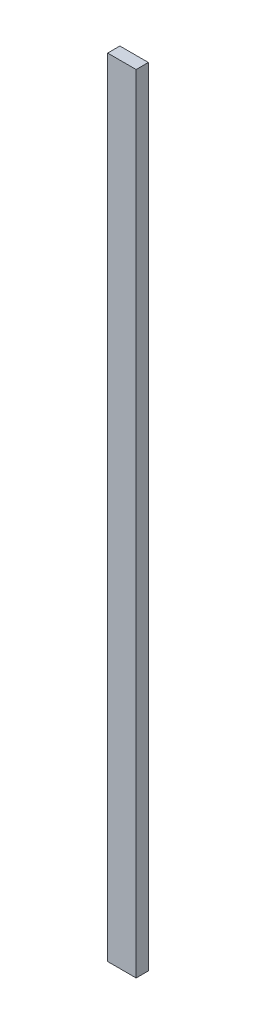
from build123d import *

# Parameters (mm, degrees)
SKETCH1_W           = 88.9
SKETCH1_H           = 38.1
BOSS_EXTRUDE1_DEPTH = 2454.148


with BuildPart() as part:
    # Sketch1 → Boss-Extrude1 (new body)
    with BuildSketch(Plane(origin=(0, 0, 0), x_dir=(1, 0, 0), z_dir=(0, 1, 0))):
        Rectangle(SKETCH1_W, SKETCH1_H)
    extrude(amount=BOSS_EXTRUDE1_DEPTH)


solid = part.part
